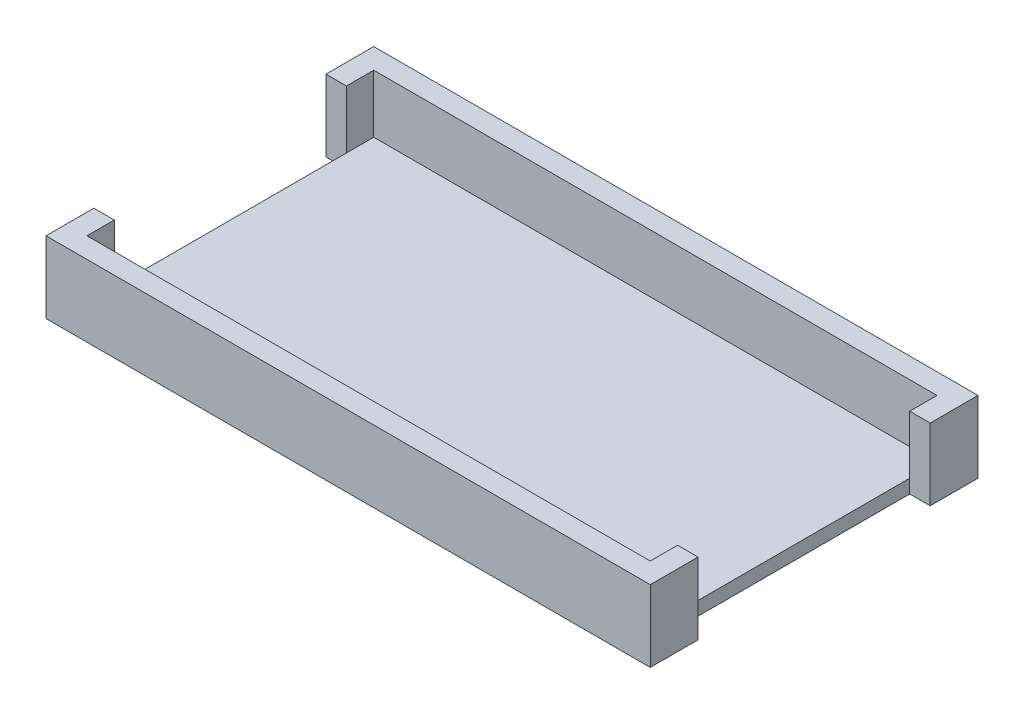
from build123d import *

# Parameters (mm, degrees)
BOSS_EXTRUDE1_DEPTH   = 5.25
BOSS_EXTRUDE1_2_DEPTH = 5.25
SKETCH1_2_W           = 41.25
SKETCH1_2_H           = 21
BOSS_EXTRUDE2_DEPTH   = 1


with BuildPart() as part:
    # Sketch1 → Boss-Extrude1 (new body)
    with BuildSketch(Plane(origin=(0, 0, 0), x_dir=(1, 0, 0), z_dir=(0, 1, 0))):
        Polygon((-22.125, 12), (-22.125, 8.5), (-20.625, 8.5), (-20.625, 10.5), (20.625, 10.5), (20.625, 8.5), (22.125, 8.5), (22.125, 12), align=None)
    extrude(amount=BOSS_EXTRUDE1_DEPTH)



with BuildPart() as body_2:
    # Sketch1 → Boss-Extrude1 2 (new body)
    with BuildSketch(Plane(origin=(0, 0, 0), x_dir=(1, 0, 0), z_dir=(0, 1, 0))):
        Polygon((-20.625, -8.5), (-22.125, -8.5), (-22.125, -12), (22.125, -12), (22.125, -8.5), (20.625, -8.5), (20.625, -10.5), (-20.625, -10.5), align=None)
    extrude(amount=BOSS_EXTRUDE1_2_DEPTH)


with BuildPart() as part_1:
    add(part.part)

    add(body_2.part)  # Boss-Extrude2 merges body 2
    # Sketch1<2> → Boss-Extrude2 (add)
    with BuildSketch(Plane(origin=(0, 0, 0), x_dir=(1, 0, 0), z_dir=(0, 1, 0))):
        Rectangle(SKETCH1_2_W, SKETCH1_2_H)
    extrude(amount=BOSS_EXTRUDE2_DEPTH)


solid = part_1.part
